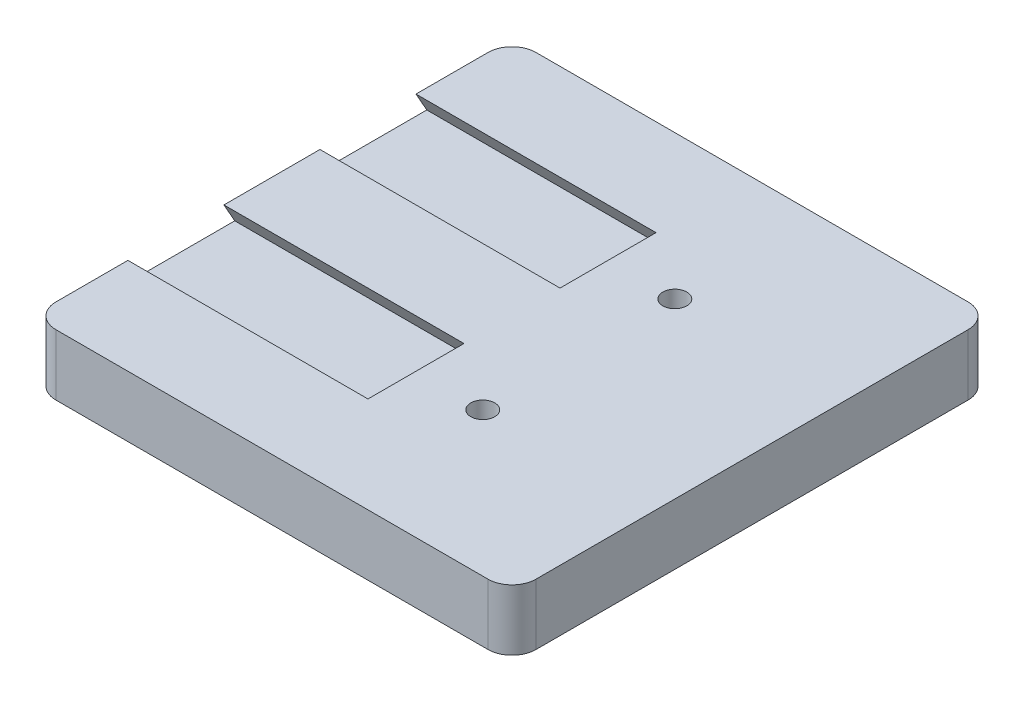
from build123d import *

# Parameters (mm, degrees)
ESBO_O2_W                = 100
ESBO_O2_H                = 100
RESSALTO_EXTRUS_O1_DEPTH = 12.7
CORTE_EXTRUS_O1_DEPTH    = 72.842118566
ESBO_O7_R                = 2.95
CORTE_EXTRUS_O3_DEPTH    = 3.5
RESSALTO_EXTRUS_O4_DEPTH = 3.5
PADR_OCIRCULAR1_COUNT    = 26
FILETE2_R                = 5
FURO_ROSCADO_DE_M61_D    = 5


with BuildPart() as part:
    # Esboço2 → Ressalto-extrusão1 (new body)
    with BuildSketch(Plane(origin=(0, 0, 0), x_dir=(1, 0, 0), z_dir=(0, 1, 0))):
        Rectangle(ESBO_O2_W, ESBO_O2_H)
    extrude(amount=RESSALTO_EXTRUS_O1_DEPTH)

    # Esboço4 → Corte-extrusão1 (cut, through all)
    with BuildSketch(Plane(origin=(0, 0, 0), x_dir=(0, 0, -1), z_dir=(1, 0, 0))):
        Polygon((-30, 12.7), (-10, 12.7), (-7.75, 8.7), (-32.25, 8.7), align=None)
    corte_extrus_o1 = extrude(amount=-CORTE_EXTRUS_O1_DEPTH, mode=Mode.SUBTRACT)

    # Espelhar1: Corte-extrusão1 across plane
    add(corte_extrus_o1.mirror(Plane.XY), mode=Mode.SUBTRACT)

    # Esboço7 → Corte-extrusão3 (cut)
    with BuildSketch(Plane.XZ):
        with Locations(Location((0, 0, 0), (0, 0, 270))):
            Circle(ESBO_O7_R)
    extrude(amount=-CORTE_EXTRUS_O3_DEPTH, mode=Mode.SUBTRACT)

    # Esboço8 → Ressalto-extrusão4 (add)
    with BuildSketch(Plane(origin=(0, 0, 0), x_dir=(-1, 0, 0), z_dir=(0, -1, 0))):
        Polygon((0, -2.78), (-0.337974861, -2.93057554), (-0.337974861, -2.981739448), (0.337974861, -2.981739448), (0.337974861, -2.93057554), align=None)
    ressalto_extrus_o4 = extrude(amount=-RESSALTO_EXTRUS_O4_DEPTH)

    # PadrãoCircular1: Ressalto-extrusão4 ×26 about axis
    padr_ocircular1_axis = Axis((0, 0, 0), (0, 1, 0))
    for i in range(1, PADR_OCIRCULAR1_COUNT):
        add(ressalto_extrus_o4.rotate(padr_ocircular1_axis, i * 360 / PADR_OCIRCULAR1_COUNT))

    # Filete2
    filete2_edges = [part.edges().sort_by_distance(p)[0] for p in [
        (-50, 6.35, -50),
        (50, 6.35, -50),
        (50, 6.35, 50),
        (-50, 6.35, 50),
    ]]
    fillet(filete2_edges, radius=FILETE2_R)

    # Furo roscado de M61 (through all)
    with Locations(Plane(origin=(0, 0, 0), x_dir=(-1, 0, 0), z_dir=(0, -1, 0))):
        with Locations((-13.9125, -20), (-13.9125, 20)):
            Hole(FURO_ROSCADO_DE_M61_D / 2)


solid = part.part
